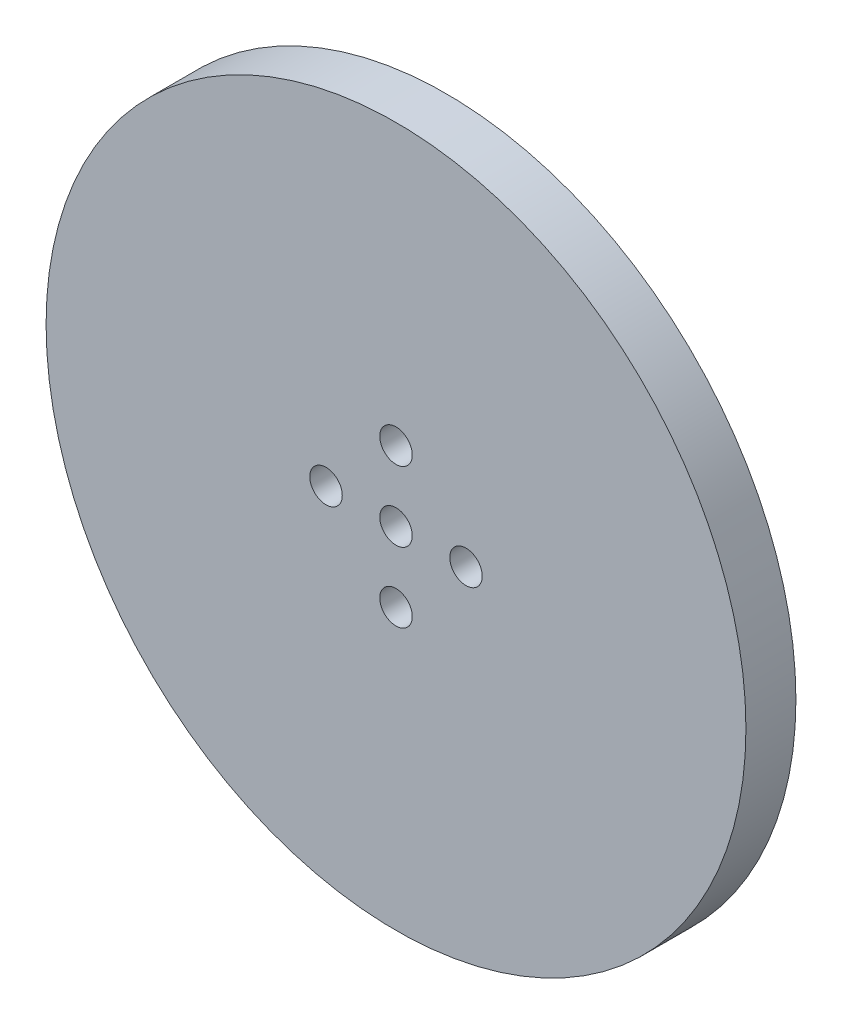
from build123d import *

# Parameters (mm, degrees)
ESQUISSE1_R        = 35
ESQUISSE1_R_2      = 1.625
BOSS_EXTRU_1_DEPTH = 5


with BuildPart() as part:
    # Esquisse1 → Boss.-Extru.1 (new body)
    with BuildSketch(Plane.XY):
        Circle(ESQUISSE1_R)
        Circle(ESQUISSE1_R_2, mode=Mode.SUBTRACT)
        with Locations((0, 7)):
            Circle(ESQUISSE1_R_2, mode=Mode.SUBTRACT)
        with Locations((7, 0)):
            Circle(ESQUISSE1_R_2, mode=Mode.SUBTRACT)
        with Locations((0, -7)):
            Circle(ESQUISSE1_R_2, mode=Mode.SUBTRACT)
        with Locations((-7, 0)):
            Circle(ESQUISSE1_R_2, mode=Mode.SUBTRACT)
    extrude(amount=BOSS_EXTRU_1_DEPTH)


solid = part.part
